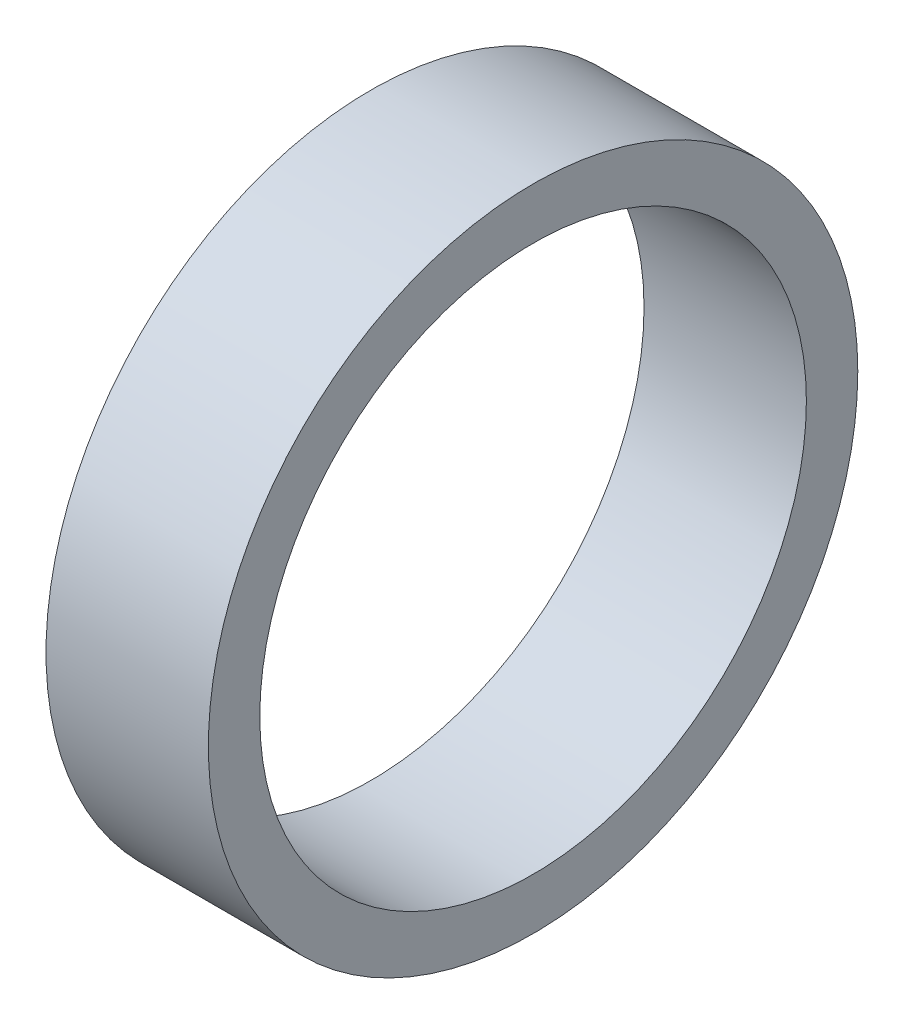
from build123d import *

# Parameters (mm, degrees)
SKETCH1_R           = 60
SKETCH1_R_2         = 50.5
BOSS_EXTRUDE1_DEPTH = 30


with BuildPart() as part:
    # Sketch1 → Boss-Extrude1 (new body)
    with BuildSketch(Plane(origin=(0, 0, 0), x_dir=(0, 0, -1), z_dir=(1, 0, 0))):
        Circle(SKETCH1_R)
        Circle(SKETCH1_R_2, mode=Mode.SUBTRACT)
    extrude(amount=BOSS_EXTRUDE1_DEPTH)


solid = part.part
